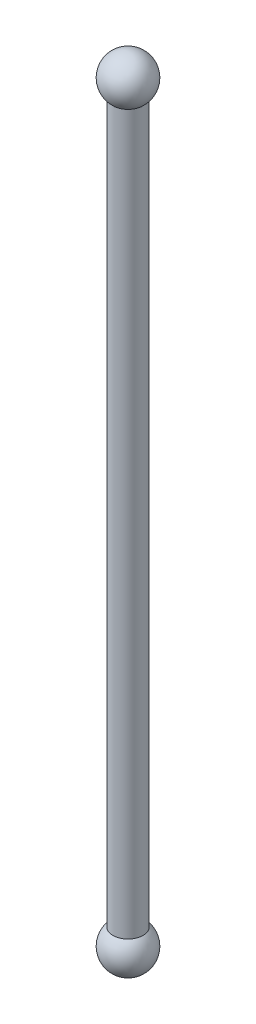
from build123d import *

# Parameters (mm, degrees)
SKETCH1_W = 10
SKETCH1_H = 478


with BuildPart() as part:
    # Sketch1 → Revolve1 (revolve)
    with BuildSketch(Plane.XY, mode=Mode.PRIVATE) as revolve1_sk:
        with Locations((-5, 0)):
            Rectangle(SKETCH1_W, SKETCH1_H)
    revolve(revolve1_sk.sketch.rotate(Axis((0, -239, 0), (0, 1, 0)), 180), axis=Axis((0, -239, 0), (0, 1, 0)))

    # Sketch2 → Revolve2 (revolve)
    with BuildSketch(Plane.XY):
        with BuildLine():
            Line((-10, 239), (0, 239))
            Line((0, 239), (0, 265.180339887))
            ThreePointArc((0, 265.180339887), (-14.012585384, 255.532671234), (-10, 239))
        make_face()
    revolve2 = revolve(axis=Axis((0, 0, 0), (0, 1, 0)))

    # Mirror1: Revolve2 across plane
    add(revolve2.mirror(Plane.ZX))


solid = part.part
